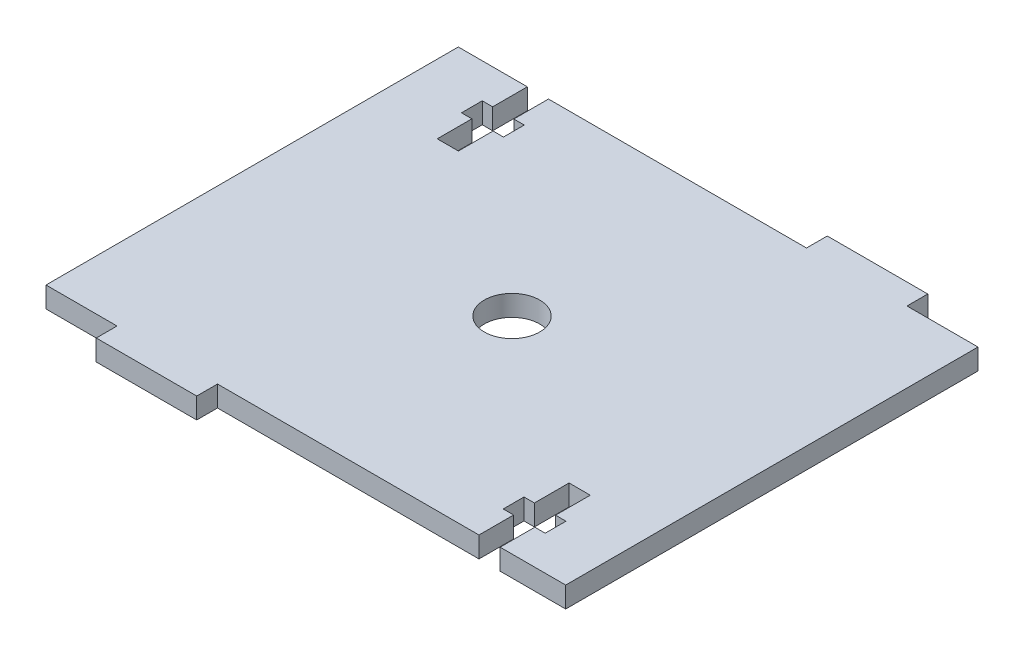
from build123d import *

# Parameters (mm, degrees)
ESQUISSE3_W        = 14.5
ESQUISSE3_H        = 3
ESQUISSE3_R        = 4
BOSS_EXTRU_1_DEPTH = 3


with BuildPart() as part:
    # Esquisse3 → Boss.-Extru.1 (new body)
    # profile 1 of 3: a face of its own
    with BuildSketch(Plane(origin=(0, 0, 0), x_dir=(1, 0, 0), z_dir=(0, 1, 0))):
        with Locations((17.5, -1.5)):
            Rectangle(ESQUISSE3_W, ESQUISSE3_H)
    # profile 2 of 3: a face of its own
    with BuildSketch(Plane(origin=(0, 0, 0), x_dir=(1, 0, 0), z_dir=(0, 1, 0))):
        Polygon((0, 59.5), (0, 0), (10.25, 0), (24.75, 0), (62.484051244, 0), (62.484051244, 5), (60.984051244, 5), (60.984051244, 8), (62.484051244, 8), (62.484051244, 13), (65.541555924, 13), (65.541555924, 8), (67.041555924, 8), (67.041555924, 5), (65.541555924, 5), (65.541555924, 0), (75, 0), (75, 59.5), (64.75, 59.5), (50.25, 59.5), (13.015948756, 59.5), (13.015948756, 54.5), (14.515948756, 54.5), (14.515948756, 51.5), (13.015948756, 51.5), (13.015948756, 46.5), (9.958444076, 46.5), (9.958444076, 51.5), (8.458444076, 51.5), (8.458444076, 54.5), (9.958444076, 54.5), (9.958444076, 59.5), align=None)
        with Locations(Location((37.5, 29.75, 0), (0, 0, 270))):
            Circle(ESQUISSE3_R, mode=Mode.SUBTRACT)
    # profile 3 of 3: a face of its own
    with BuildSketch(Plane(origin=(0, 0, 0), x_dir=(1, 0, 0), z_dir=(0, 1, 0))):
        with Locations((57.5, 61)):
            Rectangle(ESQUISSE3_W, ESQUISSE3_H)
    extrude(amount=BOSS_EXTRU_1_DEPTH)


solid = part.part
